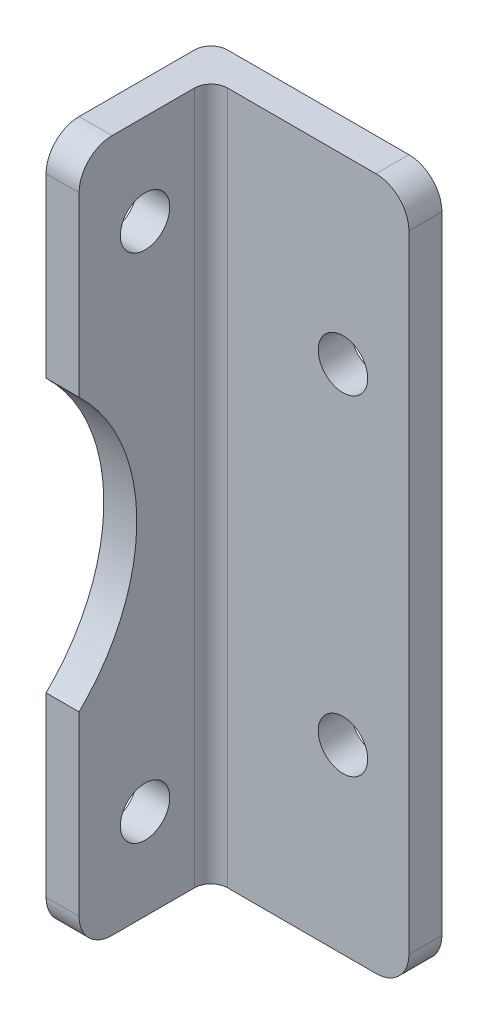
from build123d import *

# Parameters (mm, degrees)
SKETCH_1_W      = 14
SKETCH_1_H      = 42
SKETCH_1_R      = 1.5
EXTRUDE_1_DEPTH = 2
EXTRUDE_2_DEPTH = 2
FILLET_1_R      = 2
FILLET_2_R      = 1


with BuildPart() as part:
    # 草图1 → 凸台-拉伸1 (new body)
    with BuildSketch(Plane.XY):
        with Locations((-2.509513742, -8.913319239)):
            Rectangle(SKETCH_1_W, SKETCH_1_H)
        with Locations((0.490486258, 1.086680761)):
            Circle(SKETCH_1_R, mode=Mode.SUBTRACT)
        with Locations((0.490486258, -18.913319239)):
            Circle(SKETCH_1_R, mode=Mode.SUBTRACT)
    extrude(amount=EXTRUDE_1_DEPTH)

    # 草图2 → 凸台-拉伸2 (add)
    with BuildSketch(Plane.ZY.offset(9.509513742)):
        with BuildLine():
            Line((10, 12.086680761), (2, 12.086680761))
            Line((2, 12.086680761), (2, -29.913319239))
            Line((2, -29.913319239), (10, -29.913319239))
            Line((10, -29.913319239), (10, -17.17467506))
            ThreePointArc((10, -17.17467506), (6.5, -8.913319239), (10, -0.651963418))
            Line((10, -0.651963418), (10, 12.086680761))
        make_face()
        with BuildLine():
            ThreePointArc((7.5, -24.413319239), (4.939339828, -25.473979411), (6, -22.913319239))
            ThreePointArc((6, -22.913319239), (7.060660172, -23.352659067), (7.5, -24.413319239))
        make_face(mode=Mode.SUBTRACT)
        with BuildLine():
            ThreePointArc((7.5, 6.586680761), (7.060660172, 5.526020589), (6, 5.086680761))
            ThreePointArc((6, 5.086680761), (4.939339828, 7.647340933), (7.5, 6.586680761))
        make_face(mode=Mode.SUBTRACT)
    extrude(amount=-EXTRUDE_2_DEPTH)

    # 圆角1
    fillet_1_edges = [part.edges().sort_by_distance(p)[0] for p in [
        (4.490486258, -29.913319239, 1),
        (4.490486258, 12.086680761, 1),
        (-8.509513742, -29.913319239, 10),
        (-8.509513742, 12.086680761, 10),
    ]]
    fillet(fillet_1_edges, radius=FILLET_1_R)

    # 圆角2
    fillet_2_edges = [part.edges().sort_by_distance(p)[0] for p in [
        (-7.509513742, -8.913319239, 2),
        (-9.509513742, -8.913319239, 0),
    ]]
    fillet(fillet_2_edges, radius=FILLET_2_R)


solid = part.part
